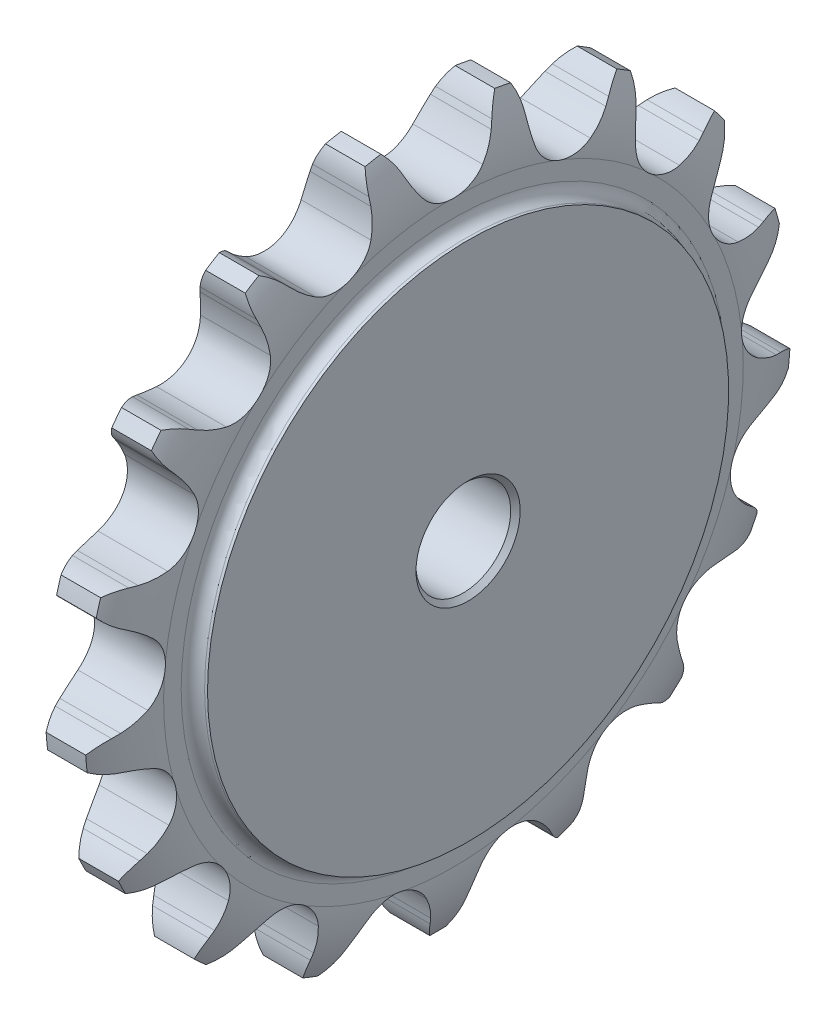
from build123d import *

# Parameters (mm, degrees)
CUT_EXTRUDE_1_DEPTH      = 10.569163814
PATTERN_CIRCULAR_1_COUNT = 17
CHAMFER_1_SIZE           = 1
CHAMFER_2_SIZE           = 1
SCALE_4_SCALE            = 0.2


with BuildPart() as part:
    # 草图1 → 旋转1 (revolve)
    with BuildSketch(Plane.XY, mode=Mode.PRIVATE) as revolve_1_sk:
        with BuildLine():
            Line((-10.569163814, 10), (-10.569163814, 55))
            Line((-10.569163814, 55), (-9.951581051, 55))
            ThreePointArc((-9.951581051, 55), (-8.204793213, 55.723543213), (-7.48125, 57.470331051))
            Line((-7.48125, 57.470331051), (-7.48125, 61.175827627))
            ThreePointArc((-7.48125, 61.175827627), (-6.747428122, 68.065209144), (-4.17925, 74.5))
            Line((-4.17925, 74.5), (4.17925, 74.5))
            ThreePointArc((4.17925, 74.5), (6.747428122, 68.065209144), (7.48125, 61.175827627))
            Line((7.48125, 61.175827627), (7.48125, 57.470331051))
            ThreePointArc((7.48125, 57.470331051), (8.204793213, 55.723543213), (9.951581051, 55))
            Line((9.951581051, 55), (10.569163814, 55))
            Line((10.569163814, 55), (10.569163814, 10))
            Line((10.569163814, 10), (-10.569163814, 10))
        make_face()
    revolve(revolve_1_sk.sketch.rotate(Axis((-12.7, 0, 0), (1, 0, 0)), 90), axis=Axis((-12.7, 0, 0), (1, 0, 0)))

    # 草图2 → 切除-拉伸1 (cut, symmetric)
    with BuildSketch(Plane(origin=(0, 0, 0), x_dir=(0, 0, -1), z_dir=(1, 0, 0))):
        with BuildLine():
            Line((9.028868565, 68.654579269), (9.635336832, 70.028098956))
            ThreePointArc((9.635336832, 70.028098956), (10.667097618, 71.885229615), (12.018963298, 73.524108436))
            ThreePointArc((12.018963298, 73.524108436), (0, 74.5), (-12.018963298, 73.524108436))
            ThreePointArc((-12.018963298, 73.524108436), (-10.667097618, 71.885229615), (-9.635336832, 70.028098956))
            Line((-9.635336832, 70.028098956), (-9.028868565, 68.654579269))
            ThreePointArc((-9.028868565, 68.654579269), (-7.801082202, 66.29602361), (-6.281541944, 64.113996673))
            ThreePointArc((-6.281541944, 64.113996673), (0, 61.086127627), (6.281541944, 64.113996673))
            ThreePointArc((6.281541944, 64.113996673), (7.801082202, 66.29602361), (9.028868565, 68.654579269))
        make_face()
    cut_extrude_1 = extrude(amount=CUT_EXTRUDE_1_DEPTH, both=True, mode=Mode.SUBTRACT)

    # 阵列(圆周)1: 切除-拉伸1 ×17 about axis
    pattern_circular_1_axis = Axis((0, 0, 0), (1, 0, 0))
    for i in range(1, PATTERN_CIRCULAR_1_COUNT):
        add(cut_extrude_1.rotate(pattern_circular_1_axis, i * 360 / PATTERN_CIRCULAR_1_COUNT), mode=Mode.SUBTRACT)

    # 倒角1
    chamfer_1_edges = [part.edges().sort_by_distance(p)[0] for p in [
        (-10.569163814, 0, -10),
    ]]
    chamfer(chamfer_1_edges, length=CHAMFER_1_SIZE)

    # 倒角2
    chamfer_2_edges = [part.edges().sort_by_distance(p)[0] for p in [
        (10.569163814, 0, -10),
    ]]
    chamfer(chamfer_2_edges, length=CHAMFER_2_SIZE)


with BuildPart() as part_1:
    # 缩放比例4: scaled about (-1e-09, 0, 0)
    add(part.part.scale(SCALE_4_SCALE).moved(Location((-1e-09, 0, 0))))


solid = part_1.part
